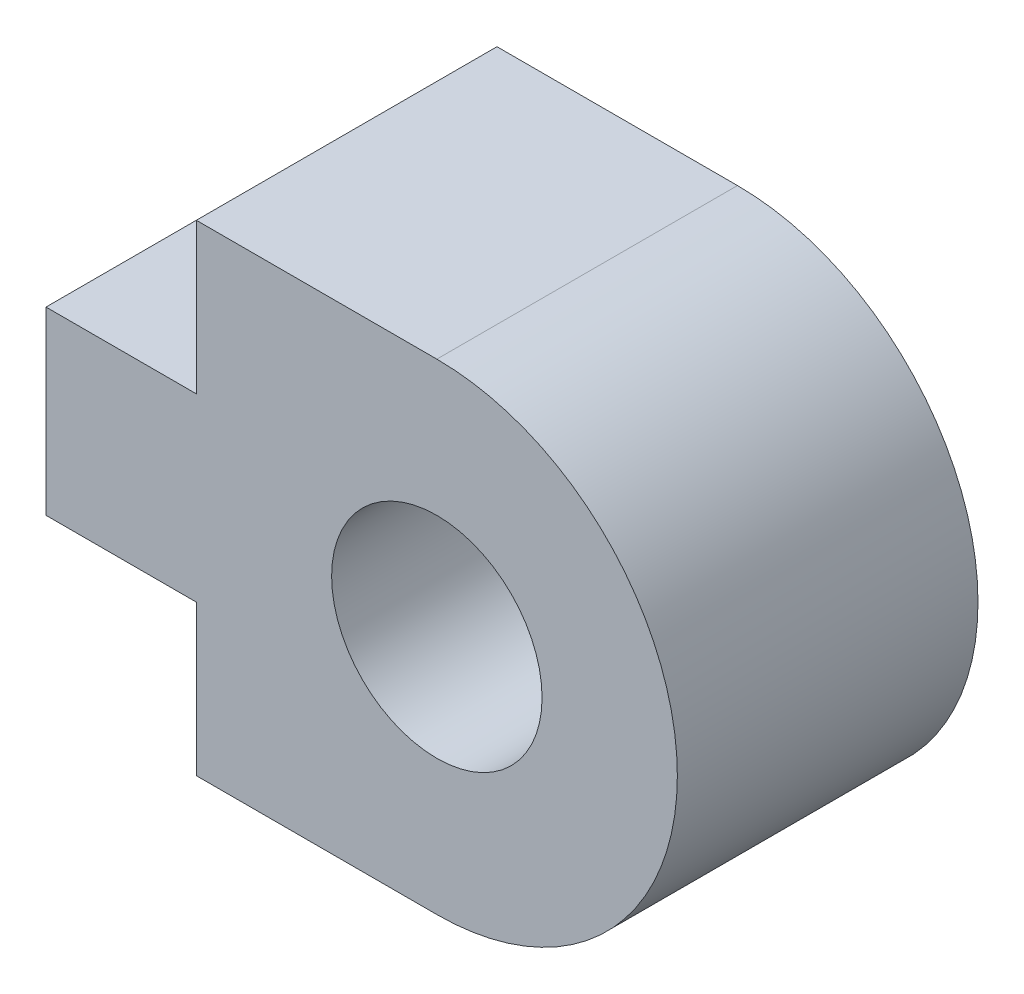
from build123d import *

# Parameters (mm, degrees)
CROQUIS1_R              = 1.75
SALIENTE_EXTRUIR1_DEPTH = 2.5


with BuildPart() as part:
    # Croquis1 → Saliente-Extruir1 (new, symmetric)
    with BuildSketch(Plane.XY):
        with BuildLine():
            Line((0, -4), (-4, -4))
            Line((-4, -4), (-4, -1.5))
            Line((-4, -1.5), (-6.5, -1.5))
            Line((-6.5, -1.5), (-6.5, 1.5))
            Line((-6.5, 1.5), (-4, 1.5))
            Line((-4, 1.5), (-4, 4))
            Line((-4, 4), (0, 4))
            ThreePointArc((0, 4), (4, 0), (0, -4))
        make_face()
        Circle(CROQUIS1_R, mode=Mode.SUBTRACT)
    extrude(amount=SALIENTE_EXTRUIR1_DEPTH, both=True)


solid = part.part
